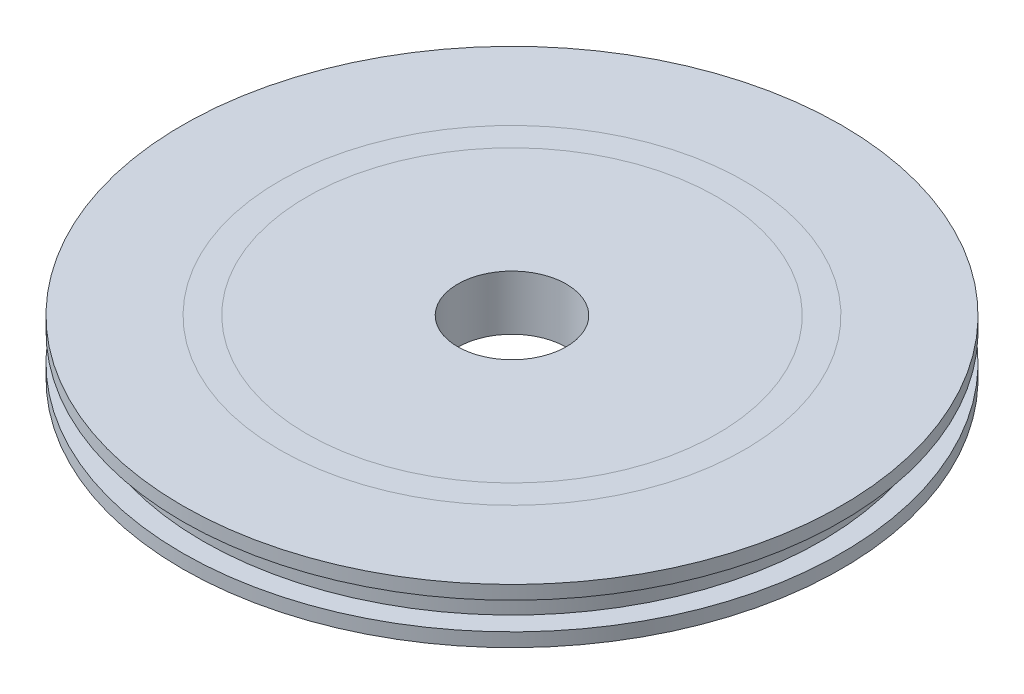
from build123d import *

# Parameters (mm, degrees)
SKETCH6_R          = 5.0419
CUT_EXTRUDE1_DEPTH = 44.553374001


with BuildPart() as part:
    # Sketch1 → Revolve1 (revolve)
    with BuildSketch(Plane(origin=(0, 0, 0), x_dir=(0, 0, -1), z_dir=(1, 0, 0))):
        Polygon((0, 0), (0, -5.08), (-30.58668, -5.08), (-30.58668, -3.81), (-28.68168, -3.81), (-28.68168, -1.27), (-30.58668, -1.27), (-30.58668, 0), align=None)
    revolve(axis=Axis((0, 0, 0), (0, -1, 0)))

    # Sketch6 → Cut-Extrude1 (cut, through all)
    with BuildSketch(Plane.XZ.offset(5.08)):
        with Locations(Location((0, 0, 0), (0, 0, 270))):
            Circle(SKETCH6_R)
    extrude(amount=-CUT_EXTRUDE1_DEPTH, mode=Mode.SUBTRACT)


solid = part.part
